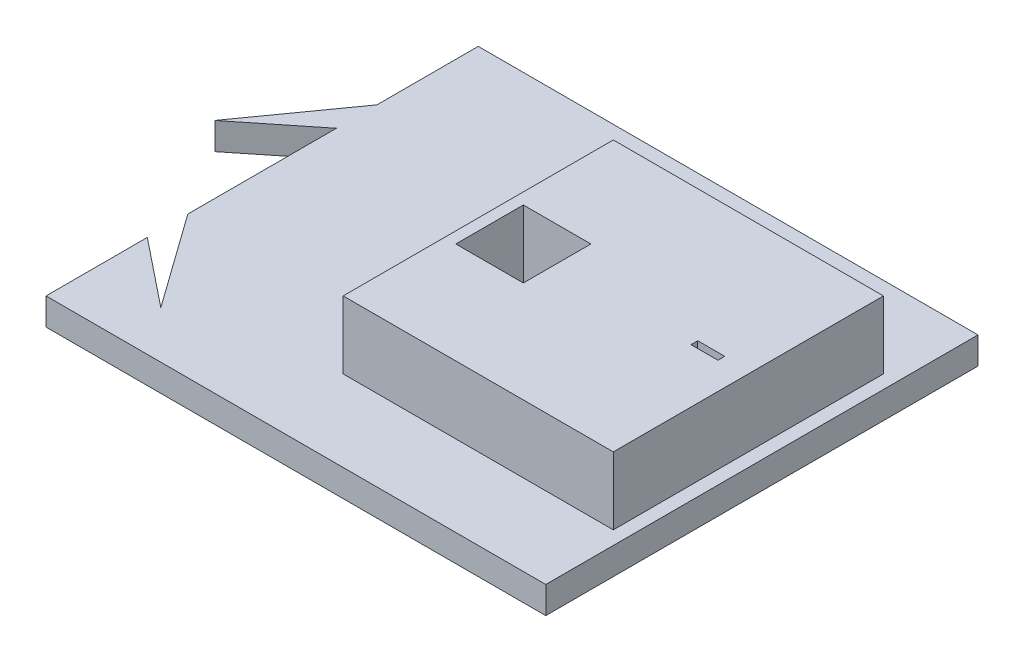
from build123d import *

# Parameters (mm, degrees)
BOSS_EXTRUDE1_DEPTH     = 20
CUT_EXTRUDE1_DEPTH      = 490.591666596
CUT_EXTRUDE1_DEPTH_BACK = 490.591666596
SKETCH2_W               = 20
SKETCH2_H               = 5
SKETCH3_W               = 200
SKETCH3_H               = 200
SKETCH3_W_2             = 50
SKETCH3_H_2             = 50
BOSS_EXTRUDE2_DEPTH     = 50
SKETCH4_W               = 20
SKETCH4_H               = 5
CUT_EXTRUDE2_DEPTH      = 495.165964024


with BuildPart() as part:
    # Sketch1 → Boss-Extrude1 (new body)
    with BuildSketch(Plane(origin=(0, 0, 0), x_dir=(1, 0, 0), z_dir=(0, 1, 0))):
        Polygon((0, 75), (50, 35), (0, 105), (0, 215), (-50, 175), (0, 245), (0, 320), (370, 320), (370, 0), (0, 0), align=None)
    extrude(amount=BOSS_EXTRUDE1_DEPTH)

    # Sketch2 → Cut-Extrude1 (cut, two sides: drawn at the far end of the back side and taken through both)
    with BuildSketch(Plane.XZ.offset(-CUT_EXTRUDE1_DEPTH_BACK)):
        with Locations((330, -160)):
            Rectangle(SKETCH2_W, SKETCH2_H)
    extrude(amount=CUT_EXTRUDE1_DEPTH + CUT_EXTRUDE1_DEPTH_BACK, mode=Mode.SUBTRACT)

    # Sketch3 → Boss-Extrude2 (add)
    with BuildSketch(Plane(origin=(0, 20, 0), x_dir=(1, 0, 0), z_dir=(0, 1, 0))):
        with Locations((260, 160)):
            Rectangle(SKETCH3_W, SKETCH3_H)
        with Locations((193.4, 160)):
            Rectangle(SKETCH3_W_2, SKETCH3_H_2, mode=Mode.SUBTRACT)
    extrude(amount=BOSS_EXTRUDE2_DEPTH)

    # Sketch4 → Cut-Extrude2 (cut, through all)
    with BuildSketch(Plane.XZ):
        with Locations((330, -160)):
            Rectangle(SKETCH4_W, SKETCH4_H)
    extrude(amount=-CUT_EXTRUDE2_DEPTH, mode=Mode.SUBTRACT)


solid = part.part
